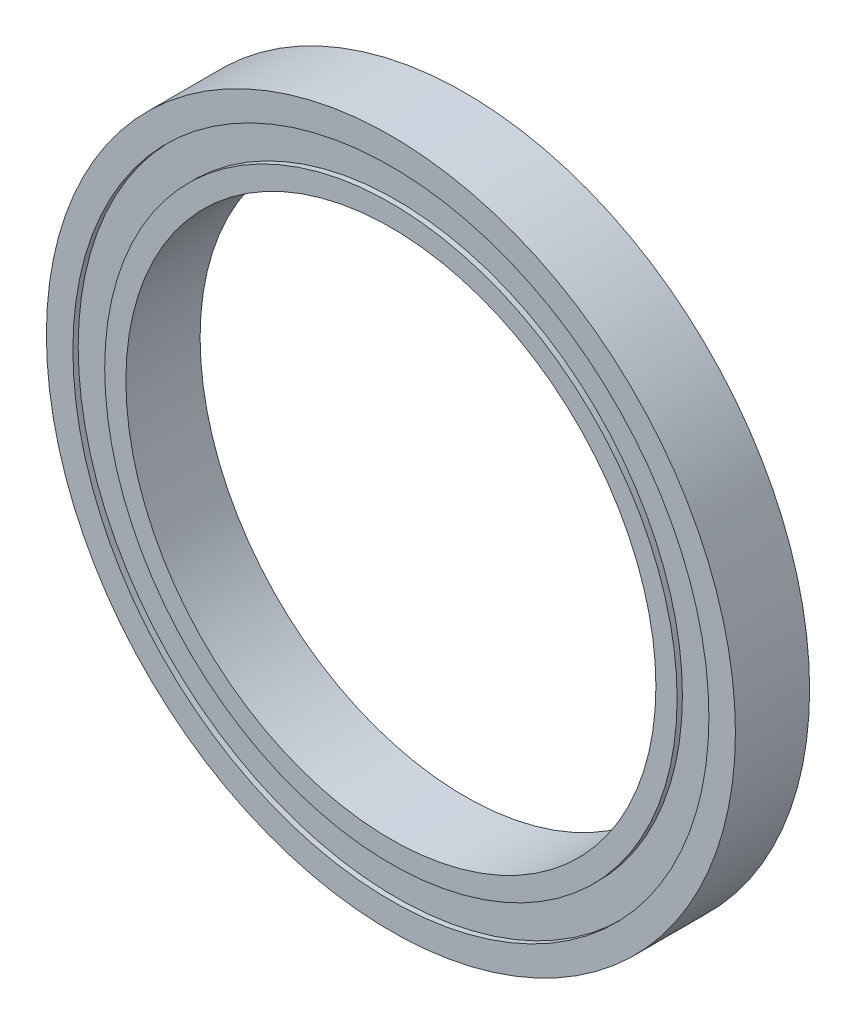
from build123d import *

# Parameters (mm, degrees)
SKETCH_1_R          = 32.5
SKETCH_1_R_2        = 25
EXTRUDE_1_DEPTH     = 3.5
SKETCH_2_R          = 30
SKETCH_2_R_2        = 27
CUT_EXTRUDE_1_DEPTH = 0.5


with BuildPart() as part:
    # 草图1 → 凸台-拉伸1 (new, symmetric)
    with BuildSketch(Plane.XY):
        Circle(SKETCH_1_R)
        Circle(SKETCH_1_R_2, mode=Mode.SUBTRACT)
    extrude(amount=EXTRUDE_1_DEPTH, both=True)

    # 草图2 → 切除-拉伸1 (cut)
    with BuildSketch(Plane.XY.offset(3.5)):
        Circle(SKETCH_2_R)
        Circle(SKETCH_2_R_2, mode=Mode.SUBTRACT)
    cut_extrude_1 = extrude(amount=-CUT_EXTRUDE_1_DEPTH, mode=Mode.SUBTRACT)

    # 镜向1: 切除-拉伸1 across plane
    add(cut_extrude_1.mirror(Plane.XY), mode=Mode.SUBTRACT)


solid = part.part
